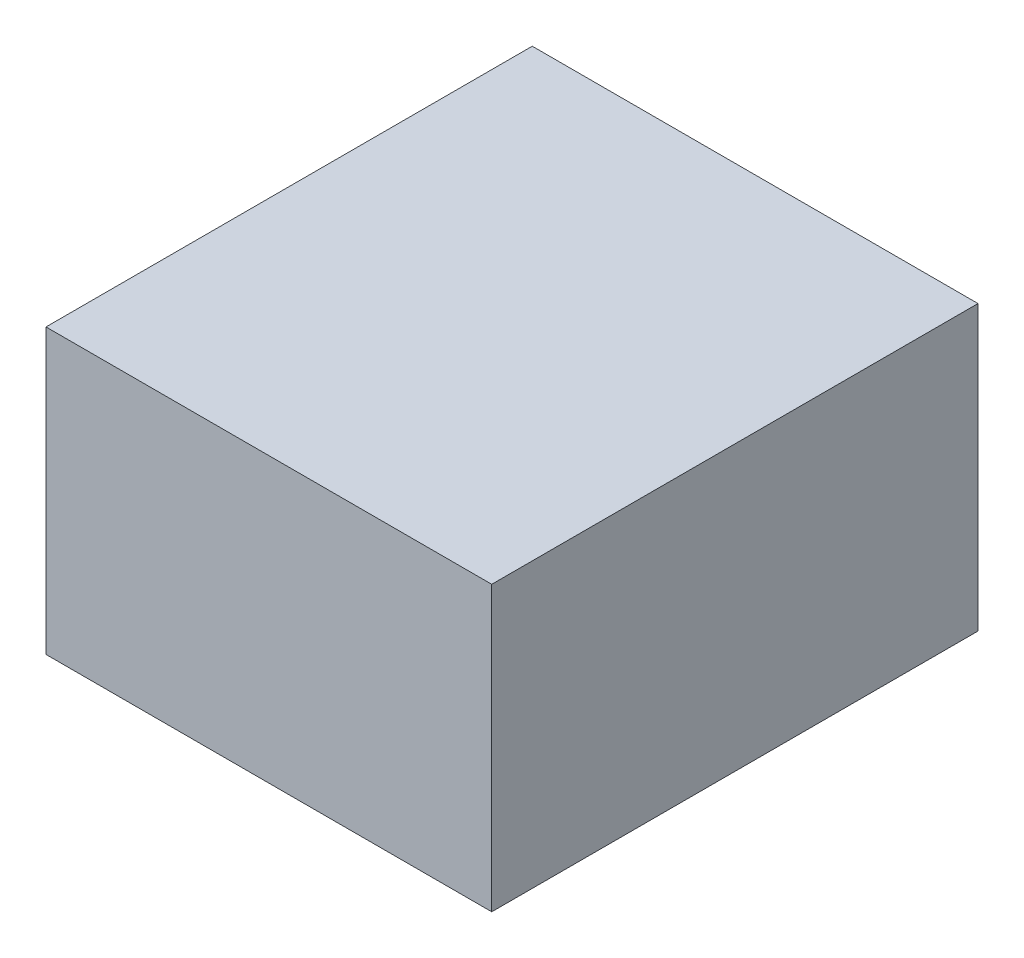
from build123d import *

# Parameters (mm, degrees)
SKETCH1_W           = 279.4
SKETCH1_H           = 177.8
BOSS_EXTRUDE1_DEPTH = 304.8


with BuildPart() as part:
    # Sketch1 → Boss-Extrude1 (new body)
    with BuildSketch(Plane.XY):
        Rectangle(SKETCH1_W, SKETCH1_H)
    extrude(amount=BOSS_EXTRUDE1_DEPTH)


solid = part.part
